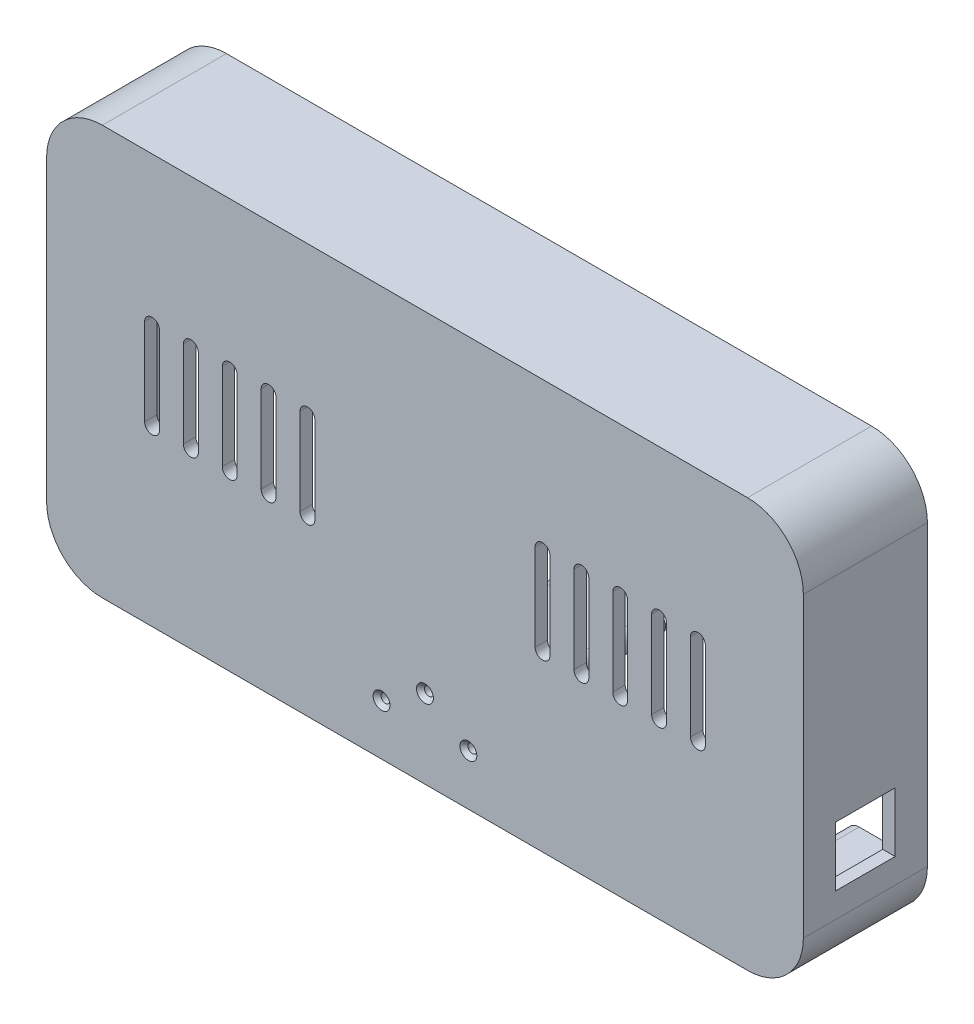
from build123d import *

# Parameters (mm, degrees)
EXTRUDE_1_DEPTH              = 50
CUT_EXTRUDE_1_DEPTH          = 45
CUT_EXTRUDE_2_DEPTH          = 5
CUT_EXTRUDE_3_DEPTH          = 5
SKETCH_1_7_R                 = 2.55
CUT_EXTRUDE_4_DEPTH          = 25
SKETCH_14_R                  = 1.6
SKETCH_14_W                  = 14
SKETCH_14_H                  = 9
USB_DEPTH                    = 5
SKETCH_16_W                  = 24
SKETCH_16_H                  = 24
CUT_EXTRUDE_12_DEPTH         = 5
SKETCH_18_W                  = 24
SKETCH_18_H                  = 24
CUT_EXTRUDE_13_DEPTH         = 5
SKETCH_29_R                  = 3.4
SKETCH_29_R_2                = 1.2
EXTRUDE_5_DEPTH              = 6.5
SKETCH_30_R                  = 1.6
CUT_EXTRUDE_21_DEPTH         = 5
HOLE_WIZARD_M3_1_D           = 3.6
HOLE_WIZARD_M3_1_CSINK_D     = 6.8
HOLE_WIZARD_M3_1_CSINK_ANGLE = 90
CUT_EXTRUDE_23_REACH         = 181.13
EXTRUDE_6_DEPTH              = 40
SKETCH_40_W                  = 10
SKETCH_40_H                  = 60
SKETCH_40_W_2                = 80
SKETCH_40_H_2                = 10
EXTRUDE_7_DEPTH              = 40


with BuildPart() as part:
    # 草图1 → 凸台-拉伸1 (new body)
    with BuildSketch(Plane.XY):
        with BuildLine():
            Line((-130, 82.5), (130, 82.5))
            ThreePointArc((130, 82.5), (145.909902577, 75.909902577), (152.5, 60))
            Line((152.5, 60), (152.5, -60))
            ThreePointArc((152.5, -60), (145.909902577, -75.909902577), (130, -82.5))
            Line((130, -82.5), (-130, -82.5))
            ThreePointArc((-130, -82.5), (-145.909902577, -75.909902577), (-152.5, -60))
            Line((-152.5, -60), (-152.5, 60))
            ThreePointArc((-152.5, 60), (-145.909902577, 75.909902577), (-130, 82.5))
        make_face()
    extrude(amount=EXTRUDE_1_DEPTH)

    # 草图1<4> → 切除-拉伸1 (cut)
    with BuildSketch(Plane.XY):
        with BuildLine():
            Line((124.95, 77.5), (-124.85, 77.5))
            Line((-124.85, 77.5), (-124.85, 60))
            ThreePointArc((-124.85, 60), (-126.358400077, 56.358400077), (-130, 54.85))
            Line((-130, 54.85), (-147.5, 54.85))
            Line((-147.5, 54.85), (-147.5, -54.85))
            Line((-147.5, -54.85), (-130, -54.85))
            ThreePointArc((-130, -54.85), (-126.358400077, -56.358400077), (-124.85, -60))
            Line((-124.85, -60), (-124.85, -77.5))
            Line((-124.85, -77.5), (124.95, -77.5))
            Line((124.95, -77.5), (124.95, -60))
            ThreePointArc((124.95, -60), (126.429110755, -56.429110755), (130, -54.95))
            Line((130, -54.95), (147.5, -54.95))
            Line((147.5, -54.95), (147.5, 54.95))
            Line((147.5, 54.95), (130, 54.95))
            ThreePointArc((130, 54.95), (126.429110755, 56.429110755), (124.95, 60))
            Line((124.95, 60), (124.95, 77.5))
        make_face()
    extrude(amount=CUT_EXTRUDE_1_DEPTH, mode=Mode.SUBTRACT)

    # 草图1<5> → 切除-拉伸2 (cut)
    with BuildSketch(Plane.XY):
        with BuildLine():
            ThreePointArc((-150.2, 60), (-144.28355698, 74.28355698), (-130, 80.2))
            Line((-130, 80.2), (130, 80.2))
            ThreePointArc((130, 80.2), (144.28355698, 74.28355698), (150.2, 60))
            Line((150.2, 60), (150.2, -60))
            ThreePointArc((150.2, -60), (144.28355698, -74.28355698), (130, -80.2))
            Line((130, -80.2), (-130, -80.2))
            ThreePointArc((-130, -80.2), (-144.28355698, -74.28355698), (-150.2, -60))
            Line((-150.2, -60), (-150.2, 60))
        make_face()
        with BuildLine():
            Line((-147.5, 60), (-147.5, -60))
            ThreePointArc((-147.5, -60), (-142.374368671, -72.374368671), (-130, -77.5))
            Line((-130, -77.5), (130, -77.5))
            ThreePointArc((130, -77.5), (142.374368671, -72.374368671), (147.5, -60))
            Line((147.5, -60), (147.5, 60))
            ThreePointArc((147.5, 60), (142.374368671, 72.374368671), (130, 77.5))
            Line((130, 77.5), (-130, 77.5))
            ThreePointArc((-130, 77.5), (-142.374368671, 72.374368671), (-147.5, 60))
        make_face(mode=Mode.SUBTRACT)
    extrude(amount=CUT_EXTRUDE_2_DEPTH, mode=Mode.SUBTRACT)

    # 草图1<6> → 切除-拉伸3 (cut)
    with BuildSketch(Plane.XY):
        with BuildLine():
            Line((-124.85, 77.5), (-130, 77.5))
            ThreePointArc((-130, 77.5), (-142.374368671, 72.374368671), (-147.5, 60))
            Line((-147.5, 60), (-147.5, 54.85))
            Line((-147.5, 54.85), (-130, 54.85))
            ThreePointArc((-130, 54.85), (-126.358400077, 56.358400077), (-124.85, 60))
            Line((-124.85, 60), (-124.85, 77.5))
        make_face()
        with BuildLine():
            Line((130, 77.5), (124.95, 77.5))
            Line((124.95, 77.5), (124.95, 60))
            ThreePointArc((124.95, 60), (126.429110755, 56.429110755), (130, 54.95))
            Line((130, 54.95), (147.5, 54.95))
            Line((147.5, 54.95), (147.5, 60))
            ThreePointArc((147.5, 60), (142.374368671, 72.374368671), (130, 77.5))
        make_face()
        with BuildLine():
            Line((-130, -54.85), (-147.5, -54.85))
            Line((-147.5, -54.85), (-147.5, -60))
            ThreePointArc((-147.5, -60), (-142.374368671, -72.374368671), (-130, -77.5))
            Line((-130, -77.5), (-124.85, -77.5))
            Line((-124.85, -77.5), (-124.85, -60))
            ThreePointArc((-124.85, -60), (-126.358400077, -56.358400077), (-130, -54.85))
        make_face()
        with BuildLine():
            Line((147.5, -60), (147.5, -54.95))
            Line((147.5, -54.95), (130, -54.95))
            ThreePointArc((130, -54.95), (126.429110755, -56.429110755), (124.95, -60))
            Line((124.95, -60), (124.95, -77.5))
            Line((124.95, -77.5), (130, -77.5))
            ThreePointArc((130, -77.5), (142.374368671, -72.374368671), (147.5, -60))
        make_face()
    extrude(amount=CUT_EXTRUDE_3_DEPTH, mode=Mode.SUBTRACT)

    # 草图1<7> → 切除-拉伸4 (cut)
    with BuildSketch(Plane.XY):
        with Locations((-130, -60)):
            Circle(SKETCH_1_7_R)
        with Locations((130, 60)):
            Circle(SKETCH_1_7_R)
        with Locations((130, -60)):
            Circle(SKETCH_1_7_R)
        with Locations((-130, 60)):
            Circle(SKETCH_1_7_R)
    extrude(amount=CUT_EXTRUDE_4_DEPTH, mode=Mode.SUBTRACT)

    # 草图14 → USB口 (cut)
    with BuildSketch(Plane.XZ.offset(82.5)):
        with Locations(Location((-70.9, 38, 0), (0, 0, 270))):
            Circle(SKETCH_14_R)
        with Locations(Location((-89.1, 38, 0), (0, 0, 270))):
            Circle(SKETCH_14_R)
        with Locations((-80, 38)):
            Rectangle(SKETCH_14_W, SKETCH_14_H)
    extrude(amount=-USB_DEPTH, mode=Mode.SUBTRACT)

    # 草图16 → 切除-拉伸12 (cut)
    with BuildSketch(Plane(origin=(152.5, 0, 0), x_dir=(0, 0, -1), z_dir=(1, 0, 0))):
        with Locations((-25, -38)):
            Rectangle(SKETCH_16_W, SKETCH_16_H)
    extrude(amount=-CUT_EXTRUDE_12_DEPTH, mode=Mode.SUBTRACT)

    # 草图18 → 切除-拉伸13 (cut)
    with BuildSketch(Plane.ZY.offset(152.5)):
        with Locations((25, -38)):
            Rectangle(SKETCH_18_W, SKETCH_18_H)
    extrude(amount=-CUT_EXTRUDE_13_DEPTH, mode=Mode.SUBTRACT)

    # 草图29 → 凸台-拉伸5 (add)
    # profile 1 of 4: a face of its own
    with BuildSketch(Plane(origin=(0, 0, 45), x_dir=(-1, 0, 0), z_dir=(0, 0, -1))):
        with Locations(Location((-30, 20, 0), (0, 0, 180))):
            Circle(SKETCH_29_R)
        with Locations(Location((-30, 20, 0), (0, 0, 180))):
            Circle(SKETCH_29_R_2, mode=Mode.SUBTRACT)
    # profile 2 of 4: a face of its own
    with BuildSketch(Plane(origin=(0, 0, 45), x_dir=(-1, 0, 0), z_dir=(0, 0, -1))):
        with Locations(Location((-30, -10, 0), (0, 0, 180))):
            Circle(SKETCH_29_R)
        with Locations(Location((-30, -10, 0), (0, 0, 180))):
            Circle(SKETCH_29_R_2, mode=Mode.SUBTRACT)
    # profile 3 of 4: a face of its own
    with BuildSketch(Plane(origin=(0, 0, 45), x_dir=(-1, 0, 0), z_dir=(0, 0, -1))):
        with Locations(Location((30, 20, 0), (0, 0, 180))):
            Circle(SKETCH_29_R)
        with Locations(Location((30, 20, 0), (0, 0, 180))):
            Circle(SKETCH_29_R_2, mode=Mode.SUBTRACT)
    # profile 4 of 4: a face of its own
    with BuildSketch(Plane(origin=(0, 0, 45), x_dir=(-1, 0, 0), z_dir=(0, 0, -1))):
        with Locations(Location((30, -10, 0), (0, 0, 180))):
            Circle(SKETCH_29_R)
        with Locations(Location((30, -10, 0), (0, 0, 180))):
            Circle(SKETCH_29_R_2, mode=Mode.SUBTRACT)
    extrude(amount=EXTRUDE_5_DEPTH)

    # 草图30 → 切除-拉伸21 (cut)
    with BuildSketch(Plane(origin=(0, 0, 45), x_dir=(-1, 0, 0), z_dir=(0, 0, -1))):
        with Locations((17.5, -62.0866)):
            Circle(SKETCH_30_R)
        with Locations((0, -50.85)):
            Circle(SKETCH_30_R)
        with Locations((-17.5, -62.0866)):
            Circle(SKETCH_30_R)
    extrude(amount=-CUT_EXTRUDE_21_DEPTH, mode=Mode.SUBTRACT)

    # M3 平头机械螺钉的锥形沉头孔1 (through all)
    with Locations(Plane.XY.offset(50)):
        with Locations((17.5, -62.0866), (0, -50.85), (-17.5, -62.0866)):
            CounterSinkHole(HOLE_WIZARD_M3_1_D / 2, HOLE_WIZARD_M3_1_CSINK_D / 2, counter_sink_angle=HOLE_WIZARD_M3_1_CSINK_ANGLE)

    # 草图38 → 切除-拉伸23 (cut, up to next)
    with BuildSketch(Plane(origin=(0, 0, 45), x_dir=(-1, 0, 0), z_dir=(0, 0, -1)), mode=Mode.PRIVATE) as cut_extrude_23_sk1:
        with BuildLine():
            Line((-107, 22.5), (-107, -12.5))
            ThreePointArc((-107, -12.5), (-110, -15.5), (-113, -12.5))
            Line((-113, -12.5), (-113, 22.5))
            ThreePointArc((-113, 22.5), (-110, 25.5), (-107, 22.5))
        make_face()
    cut_extrude_23_tool1 = extrude(cut_extrude_23_sk1.sketch, amount=-CUT_EXTRUDE_23_REACH, mode=Mode.PRIVATE) & part.part
    # 草图38 → 切除-拉伸23 (cut, up to next)
    with BuildSketch(Plane(origin=(0, 0, 45), x_dir=(-1, 0, 0), z_dir=(0, 0, -1)), mode=Mode.PRIVATE) as cut_extrude_23_sk2:
        with BuildLine():
            Line((-97.343565249, 22.5), (-97.343565249, -12.5))
            ThreePointArc((-97.343565249, -12.5), (-94.343565249, -15.5), (-91.343565249, -12.5))
            Line((-91.343565249, -12.5), (-91.343565249, 22.5))
            ThreePointArc((-91.343565249, 22.5), (-94.343565249, 25.5), (-97.343565249, 22.5))
        make_face()
    cut_extrude_23_tool2 = extrude(cut_extrude_23_sk2.sketch, amount=-CUT_EXTRUDE_23_REACH, mode=Mode.PRIVATE) & part.part
    # 草图38 → 切除-拉伸23 (cut, up to next)
    with BuildSketch(Plane(origin=(0, 0, 45), x_dir=(-1, 0, 0), z_dir=(0, 0, -1)), mode=Mode.PRIVATE) as cut_extrude_23_sk3:
        with BuildLine():
            Line((-81.687130498, 22.5), (-81.687130498, -12.5))
            ThreePointArc((-81.687130498, -12.5), (-78.687130498, -15.5), (-75.687130498, -12.5))
            Line((-75.687130498, -12.5), (-75.687130498, 22.5))
            ThreePointArc((-75.687130498, 22.5), (-78.687130498, 25.5), (-81.687130498, 22.5))
        make_face()
    cut_extrude_23_tool3 = extrude(cut_extrude_23_sk3.sketch, amount=-CUT_EXTRUDE_23_REACH, mode=Mode.PRIVATE) & part.part
    # 草图38 → 切除-拉伸23 (cut, up to next)
    with BuildSketch(Plane(origin=(0, 0, 45), x_dir=(-1, 0, 0), z_dir=(0, 0, -1)), mode=Mode.PRIVATE) as cut_extrude_23_sk4:
        with BuildLine():
            Line((-66.030695747, 22.5), (-66.030695747, -12.5))
            ThreePointArc((-66.030695747, -12.5), (-63.030695747, -15.5), (-60.030695747, -12.5))
            Line((-60.030695747, -12.5), (-60.030695747, 22.5))
            ThreePointArc((-60.030695747, 22.5), (-63.030695747, 25.5), (-66.030695747, 22.5))
        make_face()
    cut_extrude_23_tool4 = extrude(cut_extrude_23_sk4.sketch, amount=-CUT_EXTRUDE_23_REACH, mode=Mode.PRIVATE) & part.part
    # 草图38 → 切除-拉伸23 (cut, up to next)
    with BuildSketch(Plane(origin=(0, 0, 45), x_dir=(-1, 0, 0), z_dir=(0, 0, -1)), mode=Mode.PRIVATE) as cut_extrude_23_sk5:
        with BuildLine():
            Line((-50.374260997, 22.5), (-50.374260997, -12.5))
            ThreePointArc((-50.374260997, -12.5), (-47.374260997, -15.5), (-44.374260997, -12.5))
            Line((-44.374260997, -12.5), (-44.374260997, 22.5))
            ThreePointArc((-44.374260997, 22.5), (-47.374260997, 25.5), (-50.374260997, 22.5))
        make_face()
    cut_extrude_23_tool5 = extrude(cut_extrude_23_sk5.sketch, amount=-CUT_EXTRUDE_23_REACH, mode=Mode.PRIVATE) & part.part
    # 草图38 → 切除-拉伸23 (cut, up to next)
    with BuildSketch(Plane(origin=(0, 0, 45), x_dir=(-1, 0, 0), z_dir=(0, 0, -1)), mode=Mode.PRIVATE) as cut_extrude_23_sk6:
        with BuildLine():
            Line((107, 22.5), (107, -12.5))
            ThreePointArc((107, -12.5), (110, -15.5), (113, -12.5))
            Line((113, -12.5), (113, 22.5))
            ThreePointArc((113, 22.5), (110, 25.5), (107, 22.5))
        make_face()
    cut_extrude_23_tool6 = extrude(cut_extrude_23_sk6.sketch, amount=-CUT_EXTRUDE_23_REACH, mode=Mode.PRIVATE) & part.part
    # 草图38 → 切除-拉伸23 (cut, up to next)
    with BuildSketch(Plane(origin=(0, 0, 45), x_dir=(-1, 0, 0), z_dir=(0, 0, -1)), mode=Mode.PRIVATE) as cut_extrude_23_sk7:
        with BuildLine():
            Line((91.343565249, 22.5), (91.343565249, -12.5))
            ThreePointArc((91.343565249, -12.5), (94.343565249, -15.5), (97.343565249, -12.5))
            Line((97.343565249, -12.5), (97.343565249, 22.5))
            ThreePointArc((97.343565249, 22.5), (94.343565249, 25.5), (91.343565249, 22.5))
        make_face()
    cut_extrude_23_tool7 = extrude(cut_extrude_23_sk7.sketch, amount=-CUT_EXTRUDE_23_REACH, mode=Mode.PRIVATE) & part.part
    # 草图38 → 切除-拉伸23 (cut, up to next)
    with BuildSketch(Plane(origin=(0, 0, 45), x_dir=(-1, 0, 0), z_dir=(0, 0, -1)), mode=Mode.PRIVATE) as cut_extrude_23_sk8:
        with BuildLine():
            Line((75.687130498, 22.5), (75.687130498, -12.5))
            ThreePointArc((75.687130498, -12.5), (78.687130498, -15.5), (81.687130498, -12.5))
            Line((81.687130498, -12.5), (81.687130498, 22.5))
            ThreePointArc((81.687130498, 22.5), (78.687130498, 25.5), (75.687130498, 22.5))
        make_face()
    cut_extrude_23_tool8 = extrude(cut_extrude_23_sk8.sketch, amount=-CUT_EXTRUDE_23_REACH, mode=Mode.PRIVATE) & part.part
    # 草图38 → 切除-拉伸23 (cut, up to next)
    with BuildSketch(Plane(origin=(0, 0, 45), x_dir=(-1, 0, 0), z_dir=(0, 0, -1)), mode=Mode.PRIVATE) as cut_extrude_23_sk9:
        with BuildLine():
            Line((60.030695747, 22.5), (60.030695747, -12.5))
            ThreePointArc((60.030695747, -12.5), (63.030695747, -15.5), (66.030695747, -12.5))
            Line((66.030695747, -12.5), (66.030695747, 22.5))
            ThreePointArc((66.030695747, 22.5), (63.030695747, 25.5), (60.030695747, 22.5))
        make_face()
    cut_extrude_23_tool9 = extrude(cut_extrude_23_sk9.sketch, amount=-CUT_EXTRUDE_23_REACH, mode=Mode.PRIVATE) & part.part
    # 草图38 → 切除-拉伸23 (cut, up to next)
    with BuildSketch(Plane(origin=(0, 0, 45), x_dir=(-1, 0, 0), z_dir=(0, 0, -1)), mode=Mode.PRIVATE) as cut_extrude_23_sk10:
        with BuildLine():
            Line((44.374260997, 22.5), (44.374260997, -12.5))
            ThreePointArc((44.374260997, -12.5), (47.374260997, -15.5), (50.374260997, -12.5))
            Line((50.374260997, -12.5), (50.374260997, 22.5))
            ThreePointArc((50.374260997, 22.5), (47.374260997, 25.5), (44.374260997, 22.5))
        make_face()
    cut_extrude_23_tool10 = extrude(cut_extrude_23_sk10.sketch, amount=-CUT_EXTRUDE_23_REACH, mode=Mode.PRIVATE) & part.part
    add(cut_extrude_23_tool1.solids().sort_by_distance((110, 5, 45))[0], mode=Mode.SUBTRACT)
    add(cut_extrude_23_tool2.solids().sort_by_distance((94.343565, 5, 45))[0], mode=Mode.SUBTRACT)
    add(cut_extrude_23_tool3.solids().sort_by_distance((78.68713, 5, 45))[0], mode=Mode.SUBTRACT)
    add(cut_extrude_23_tool4.solids().sort_by_distance((63.030696, 5, 45))[0], mode=Mode.SUBTRACT)
    add(cut_extrude_23_tool5.solids().sort_by_distance((47.374261, 5, 45))[0], mode=Mode.SUBTRACT)
    add(cut_extrude_23_tool6.solids().sort_by_distance((-110, 5, 45))[0], mode=Mode.SUBTRACT)
    add(cut_extrude_23_tool7.solids().sort_by_distance((-94.343565, 5, 45))[0], mode=Mode.SUBTRACT)
    add(cut_extrude_23_tool8.solids().sort_by_distance((-78.68713, 5, 45))[0], mode=Mode.SUBTRACT)
    add(cut_extrude_23_tool9.solids().sort_by_distance((-63.030696, 5, 45))[0], mode=Mode.SUBTRACT)
    add(cut_extrude_23_tool10.solids().sort_by_distance((-47.374261, 5, 45))[0], mode=Mode.SUBTRACT)

    # 草图39 → 凸台-拉伸6 (add)
    with BuildSketch(Plane(origin=(0, 0, 45), x_dir=(-1, 0, 0), z_dir=(0, 0, -1))):
        with BuildLine():
            Line((-18, -28), (-48, -28))
            ThreePointArc((-48, -28), (-52, -24), (-48, -20))
            Line((-48, -20), (-18, -20))
            ThreePointArc((-18, -20), (-14, -24), (-18, -28))
        make_face()
        with BuildLine():
            Line((18, -28), (48, -28))
            ThreePointArc((48, -28), (52, -24), (48, -20))
            Line((48, -20), (18, -20))
            ThreePointArc((18, -20), (14, -24), (18, -28))
        make_face()
    extrude(amount=EXTRUDE_6_DEPTH)

    # 草图40 → 凸台-拉伸7 (add)
    with BuildSketch(Plane(origin=(0, 0, 45), x_dir=(-1, 0, 0), z_dir=(0, 0, -1))):
        with Locations((142.5, 24.95)):
            Rectangle(SKETCH_40_W, SKETCH_40_H)
        with Locations((-142.5, 24.95)):
            Rectangle(SKETCH_40_W, SKETCH_40_H)
        with Locations((0, 72.5)):
            Rectangle(SKETCH_40_W_2, SKETCH_40_H_2)
    extrude(amount=EXTRUDE_7_DEPTH)


solid = part.part
